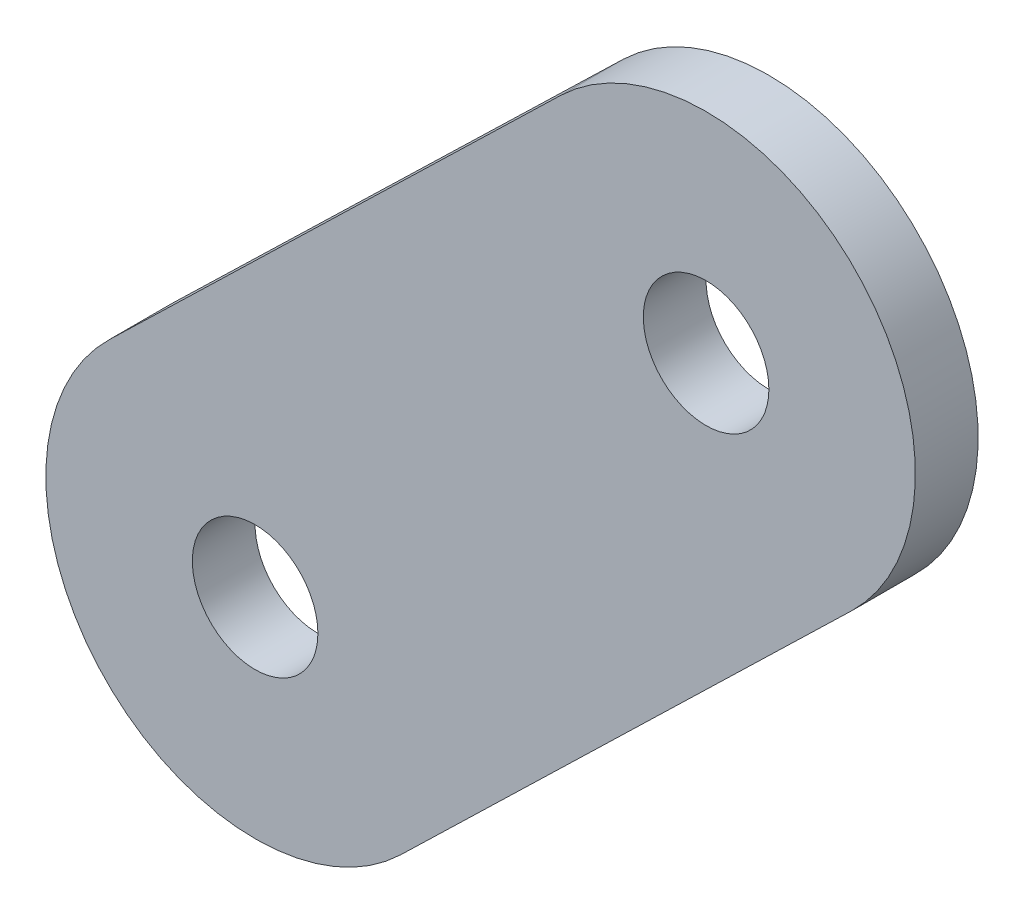
from build123d import *

# Parameters (mm, degrees)
SKETCH1_R           = 3
BOSS_EXTRUDE1_DEPTH = 3


with BuildPart() as part:
    # Sketch1 → Boss-Extrude1 (new body)
    with BuildSketch(Plane.XY):
        with BuildLine():
            Line((31.11182518, 35.293969223), (52.661145296, 56.165643869))
            ThreePointArc((52.661145296, 56.165643869), (52.887027119, 70.305975457), (38.746695531, 70.53185728))
            Line((38.746695531, 70.53185728), (17.197375416, 49.660182633))
            ThreePointArc((17.197375416, 49.660182633), (16.971493592, 35.519851046), (31.11182518, 35.293969223))
        make_face()
        with Locations((24.154600298, 42.477075928)):
            Circle(SKETCH1_R, mode=Mode.SUBTRACT)
        with Locations((45.703920413, 63.348750575)):
            Circle(SKETCH1_R, mode=Mode.SUBTRACT)
    extrude(amount=BOSS_EXTRUDE1_DEPTH)


solid = part.part
